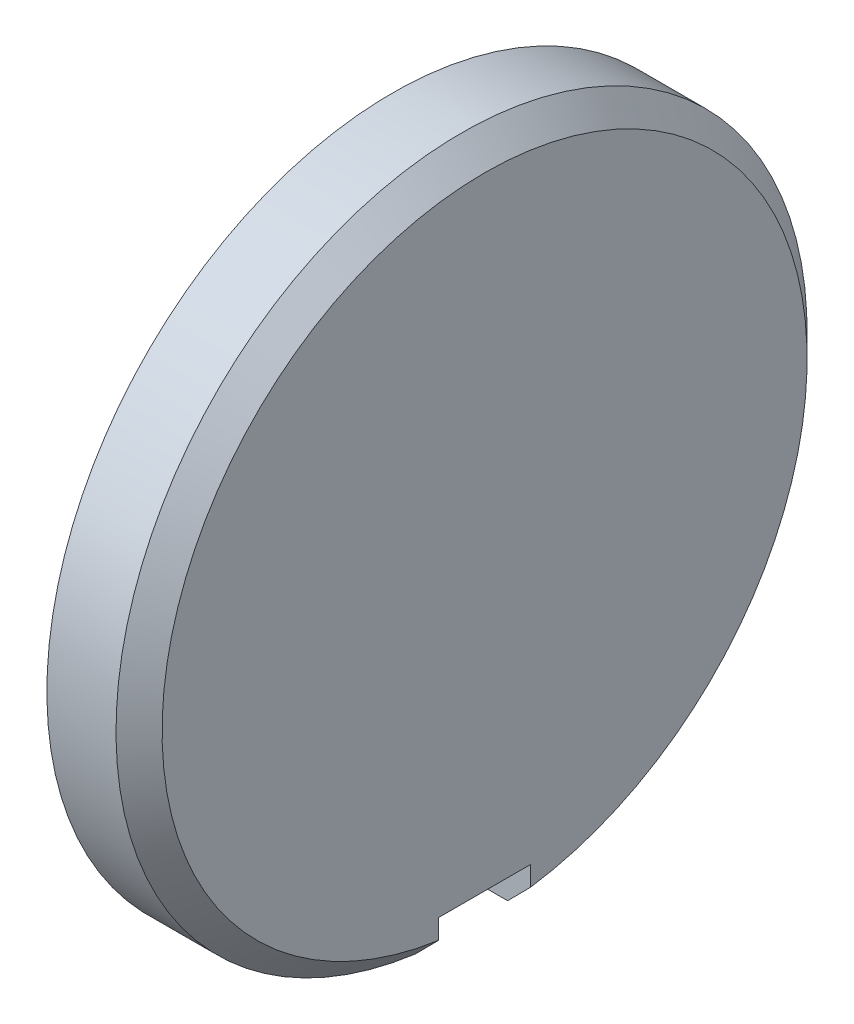
from build123d import *

# Parameters (mm, degrees)
BOSS_EXTRUDE1_START = -55.2
SKETCH2_W           = 1.28
SKETCH2_H           = 0.8
BOSS_EXTRUDE1_DEPTH = 6.4
BOSS_EXTRUDE2_START = -52.4
SKETCH3_W           = 1.28
SKETCH3_H           = 6.4
BOSS_EXTRUDE2_DEPTH = 0.8
BOSS_EXTRUDE3_START = -52.8
SKETCH4_W           = 1.8
SKETCH4_H           = 0.9
BOSS_EXTRUDE3_DEPTH = 1.6


with BuildPart() as part:
    # Sketch1 → Revolve1 (revolve)
    with BuildSketch(Plane.XY.offset(-52), mode=Mode.PRIVATE) as revolve1_sk:
        Polygon((74, -17.7), (75.2, -17.7), (75.2, -20), (76.8, -20), (76.8, -14.4), (76.4, -14), (75.2, -14), (75.2, -17), (74, -17), align=None)
    revolve(revolve1_sk.sketch.rotate(Axis((69, -20, -52), (1, 0, 0)), 90), axis=Axis((69, -20, -52), (1, 0, 0)))


with BuildPart() as body_2:
    # Sketch2 → Boss-Extrude1 (new body)
    with BuildSketch(Plane.XY.offset(BOSS_EXTRUDE1_START)):
        with Locations((74.54, -20)):
            Rectangle(SKETCH2_W, SKETCH2_H)
    extrude(amount=BOSS_EXTRUDE1_DEPTH)


with BuildPart() as part_1:
    add(part.part)

    # Combine1: cut body 2
    add(body_2.part, mode=Mode.SUBTRACT)


with BuildPart() as body_2_2:
    # Sketch3 → Boss-Extrude2 (new body)
    with BuildSketch(Plane.XY.offset(BOSS_EXTRUDE2_START)):
        with Locations((74.54, -20)):
            Rectangle(SKETCH3_W, SKETCH3_H)
    extrude(amount=BOSS_EXTRUDE2_DEPTH)


with BuildPart() as part_2:
    add(part_1.part)

    # Combine2: cut body 2 2
    add(body_2_2.part, mode=Mode.SUBTRACT)


with BuildPart() as body_2_3:
    # Sketch4 → Boss-Extrude3 (new body)
    with BuildSketch(Plane.XY.offset(BOSS_EXTRUDE3_START)):
        with Locations((76, -25.65)):
            Rectangle(SKETCH4_W, SKETCH4_H)
    extrude(amount=BOSS_EXTRUDE3_DEPTH)


with BuildPart() as part_3:
    add(part_2.part)

    # Combine3: cut body 2 3
    add(body_2_3.part, mode=Mode.SUBTRACT)


solid = part_3.part
